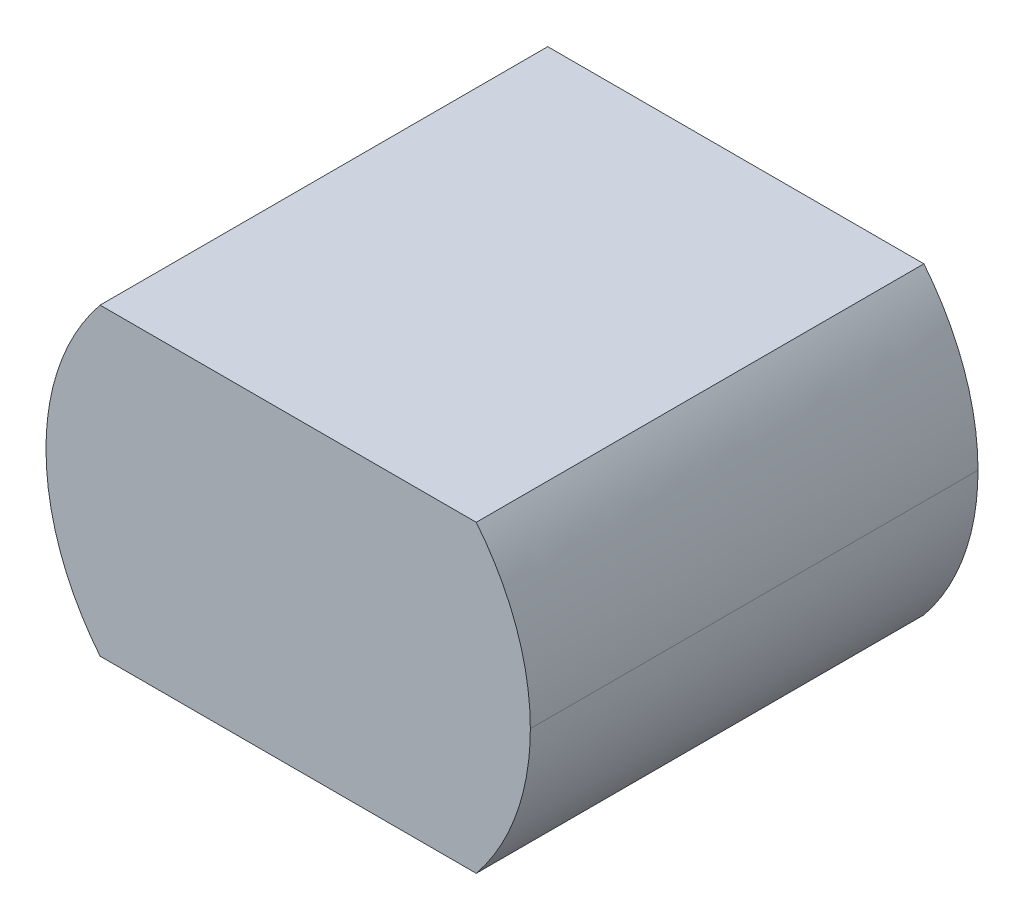
from build123d import *

# Parameters (mm, degrees)
BOSS_EXTRUDE1_DEPTH = 6.35


with BuildPart() as part:
    # Model → Boss-Extrude1 (new body)
    with BuildSketch(Plane.XY):
        with BuildLine():
            add(Edge.make_bspline(
                [(96.223229, 224.964432), (96.223229, 224.146283), (96.512837, 223.393521), (96.990521, 222.803668)],
                knots=[0, 0, 0, 0, 1, 1, 1, 1], degree=3))
            Line((96.990521, 222.803668), (102.326282, 222.803668))
            add(Edge.make_bspline(
                [(102.326282, 222.803668), (102.803966, 223.393521), (103.093574, 224.146283), (103.093574, 224.964432)],
                knots=[0, 0, 0, 0, 1, 1, 1, 1], degree=3))
            add(Edge.make_bspline(
                [(103.093574, 224.964432), (103.093574, 225.78258), (102.803966, 226.526523), (102.326282, 227.116376)],
                knots=[0, 0, 0, 0, 1, 1, 1, 1], degree=3))
            Line((102.326282, 227.116376), (96.990521, 227.116376))
            add(Edge.make_bspline(
                [(96.990521, 227.116376), (96.512837, 226.526523), (96.223229, 225.78258), (96.223229, 224.964432)],
                knots=[0, 0, 0, 0, 1, 1, 1, 1], degree=3))
        make_face()
    extrude(amount=BOSS_EXTRUDE1_DEPTH)


solid = part.part
